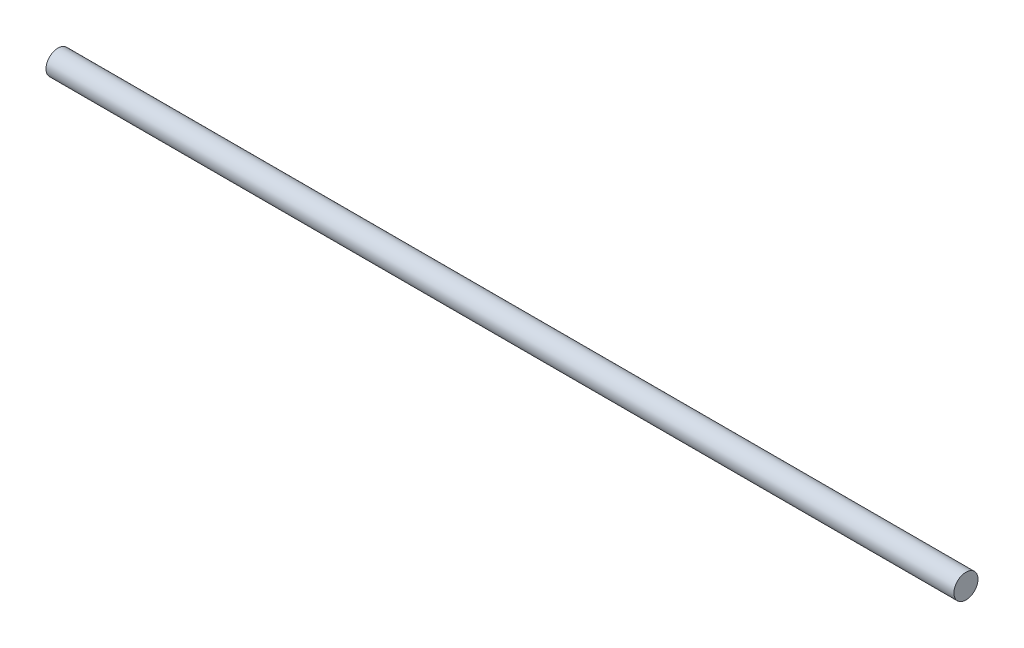
from build123d import *

# Parameters (mm, degrees)
SKETCH1_R           = 3.985
BOSS_EXTRUDE1_DEPTH = 150


with BuildPart() as part:
    # Sketch1 → Boss-Extrude1 (new, symmetric)
    with BuildSketch(Plane(origin=(0, 0, 0), x_dir=(0, 0, -1), z_dir=(1, 0, 0))):
        Circle(SKETCH1_R)
    extrude(amount=BOSS_EXTRUDE1_DEPTH, both=True)


solid = part.part
